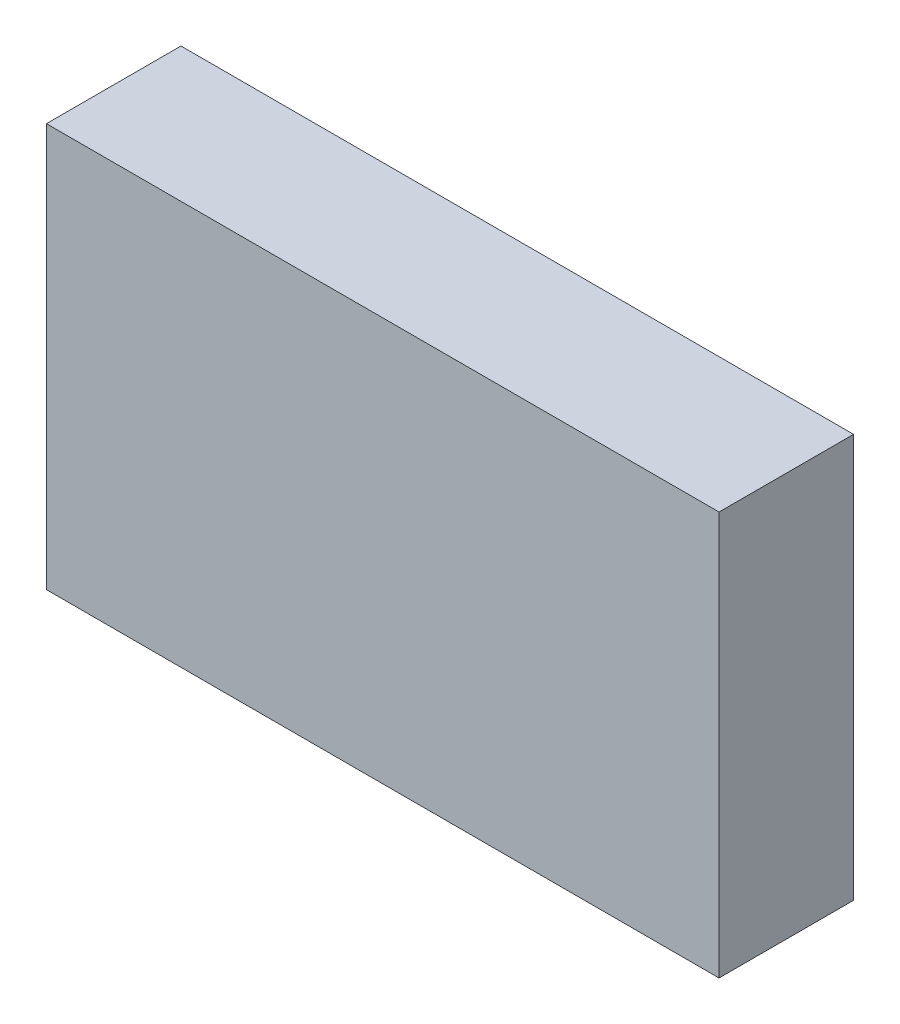
from build123d import *

# Parameters (mm, degrees)
SKETCH1_W           = 100
SKETCH1_H           = 60
BOSS_EXTRUDE1_DEPTH = 20


with BuildPart() as part:
    # Sketch1 → Boss-Extrude1 (new body)
    with BuildSketch(Plane.XY):
        with Locations((50, 30)):
            Rectangle(SKETCH1_W, SKETCH1_H)
    extrude(amount=BOSS_EXTRUDE1_DEPTH)


solid = part.part
